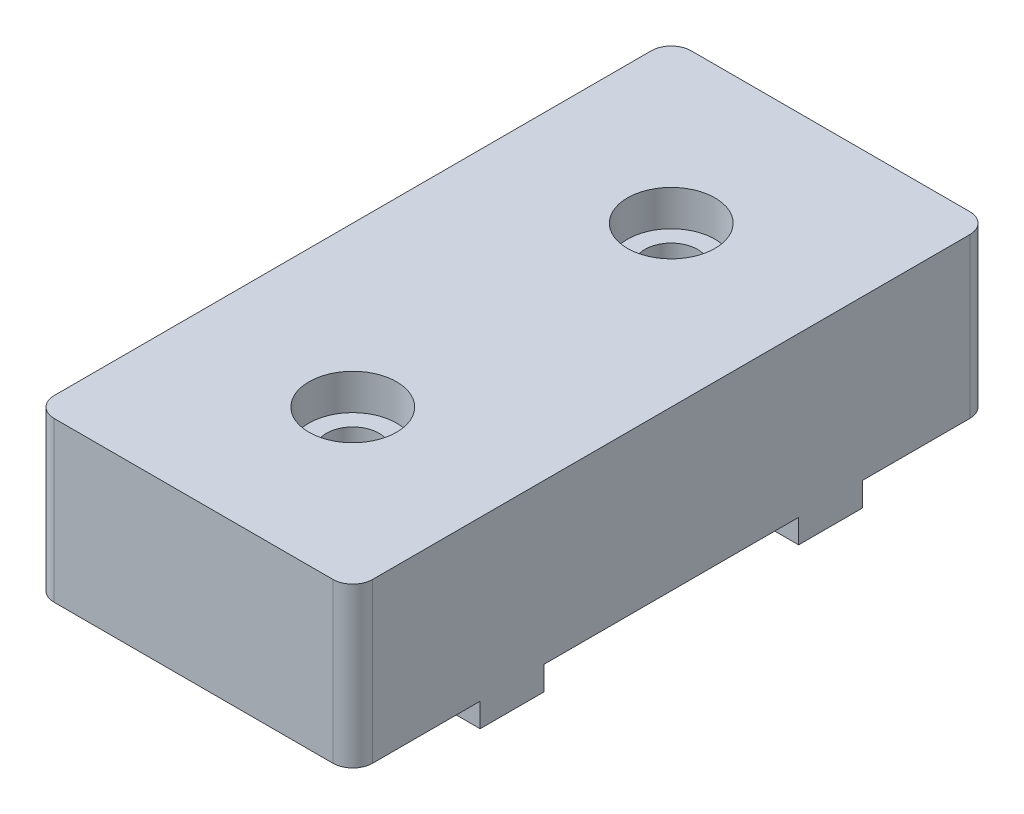
from build123d import *

# Parameters (mm, degrees)
SKETCH1_W                                            = 40
SKETCH1_H                                            = 80
BOSS_EXTRUDE1_DEPTH                                  = 20
SKETCH2_W                                            = 40
SKETCH2_H                                            = 8
BOSS_EXTRUDE2_DEPTH                                  = 3
CBORE_FOR_M6_HEX_SOCKET_THIN_HEAD_CAP_SC_D           = 6.6
CBORE_FOR_M6_HEX_SOCKET_THIN_HEAD_CAP_SC_DEPTH       = 24.5
CBORE_FOR_M6_HEX_SOCKET_THIN_HEAD_CAP_SC_CBORE_D     = 11
CBORE_FOR_M6_HEX_SOCKET_THIN_HEAD_CAP_SC_CBORE_DEPTH = 4.5
M8_TAPPED_HOLE1_D                                    = 6.8
M8_TAPPED_HOLE1_DEPTH                                = 33.75
FILLET1_R                                            = 2.5


with BuildPart() as part:
    # Sketch1 → Boss-Extrude1 (new body)
    with BuildSketch(Plane(origin=(0, 0, 0), x_dir=(1, 0, 0), z_dir=(0, 1, 0))):
        Rectangle(SKETCH1_W, SKETCH1_H)
    extrude(amount=BOSS_EXTRUDE1_DEPTH)

    # Sketch2 → Boss-Extrude2 (add)
    with BuildSketch(Plane(origin=(0, 0, 0), x_dir=(1, 0, 0), z_dir=(0, 1, 0))):
        with Locations((0, -20)):
            Rectangle(SKETCH2_W, SKETCH2_H)
        with Locations((0, 20)):
            Rectangle(SKETCH2_W, SKETCH2_H)
    extrude(amount=-BOSS_EXTRUDE2_DEPTH)

    # CBORE for M6 Hex Socket Thin Head Cap Screw1
    with Locations(Plane(origin=(0, 20, 0), x_dir=(1, 0, 0), z_dir=(0, 1, 0))):
        with Locations((0, -20), (0, 20)):
            CounterBoreHole(CBORE_FOR_M6_HEX_SOCKET_THIN_HEAD_CAP_SC_D / 2, CBORE_FOR_M6_HEX_SOCKET_THIN_HEAD_CAP_SC_CBORE_D / 2, CBORE_FOR_M6_HEX_SOCKET_THIN_HEAD_CAP_SC_CBORE_DEPTH, depth=CBORE_FOR_M6_HEX_SOCKET_THIN_HEAD_CAP_SC_DEPTH)

    # M8 Tapped Hole1
    with Locations(Plane.ZY.offset(20)):
        with Locations((0, 10)):
            Hole(M8_TAPPED_HOLE1_D / 2, depth=M8_TAPPED_HOLE1_DEPTH)

    # Fillet1
    fillet1_edges = [part.edges().sort_by_distance(p)[0] for p in [
        (-20, 10, -40),
        (20, 10, -40),
        (20, 10, 40),
        (-20, 10, 40),
    ]]
    fillet(fillet1_edges, radius=FILLET1_R)


solid = part.part
